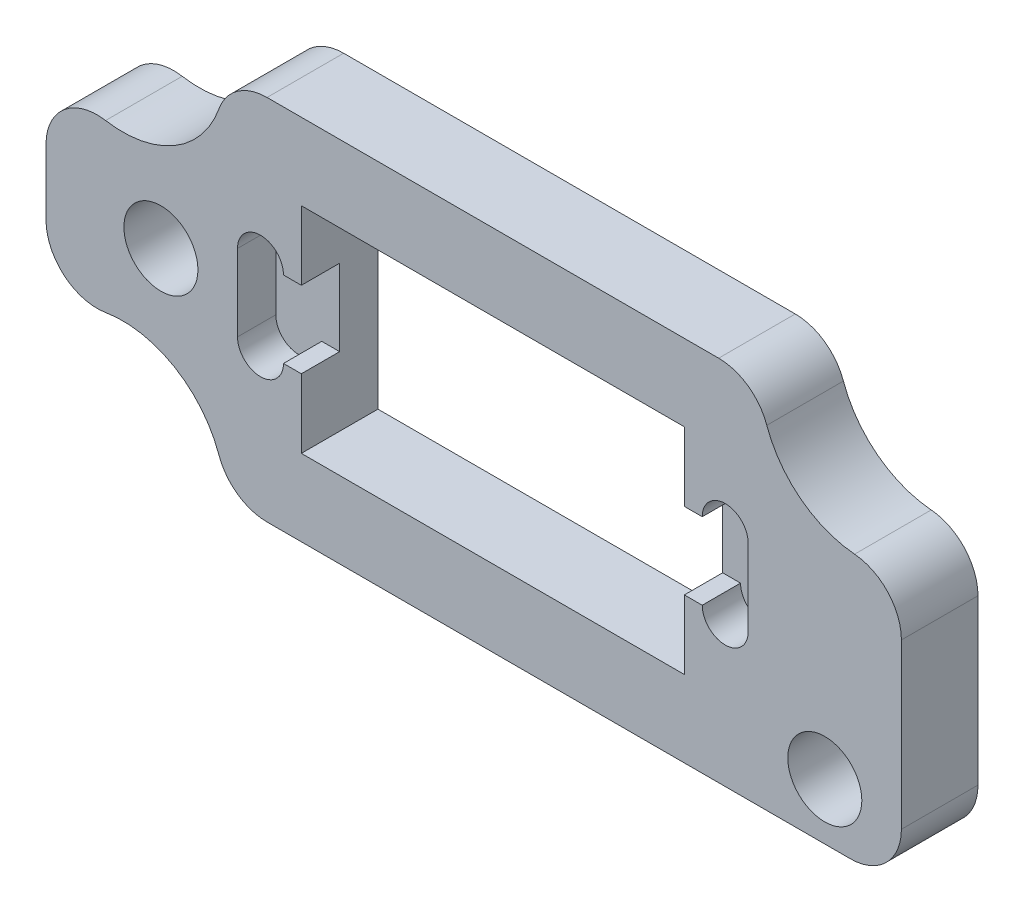
from build123d import *

# Parameters (mm, degrees)
SKETCH_1_W          = 35
SKETCH_1_H          = 14.4
SKETCH_1_W_2        = 15
SKETCH_1_H_2        = 8.4
EXTRUDE_1_DEPTH     = 3
SKETCH_2_W          = 20
SKETCH_2_H          = 3
CUT_EXTRUDE_1_DEPTH = 1.5
SKETCH_3_R          = 1.45
CUT_EXTRUDE_2_DEPTH = 20
SKETCH_5_R          = 4
CUT_EXTRUDE_4_DEPTH = 10
SKETCH_9_W          = 1.5
SKETCH_9_H          = 14.4
CUT_EXTRUDE_7_DEPTH = 20.159592898
FILLET_2_R          = 2
SKETCH_6_R          = 0.9
CUT_EXTRUDE_5_DEPTH = 1.5
SKETCH_7_R          = 1.45
CUT_EXTRUDE_6_DEPTH = 20.159592898


with BuildPart() as part:
    # 草图1 → 凸台-拉伸1 (new body)
    with BuildSketch(Plane.XY):
        Rectangle(SKETCH_1_W, SKETCH_1_H)
        Rectangle(SKETCH_1_W_2, SKETCH_1_H_2, mode=Mode.SUBTRACT)
    extrude(amount=EXTRUDE_1_DEPTH)

    # 草图2 → 切除-拉伸1 (cut)
    with BuildSketch(Plane.XY.offset(3)):
        Rectangle(SKETCH_2_W, SKETCH_2_H)
    extrude(amount=-CUT_EXTRUDE_1_DEPTH, mode=Mode.SUBTRACT)

    # 草图3 → 切除-拉伸2 (cut)
    with BuildSketch(Plane.XY.offset(3)):
        with Locations((-13, 0)):
            Circle(SKETCH_3_R)
    extrude(amount=-CUT_EXTRUDE_2_DEPTH, mode=Mode.SUBTRACT)

    # 草图5 → 切除-拉伸4 (cut)
    with BuildSketch(Plane.XY.offset(3)):
        with Locations((-14.5, 7.2)):
            Circle(SKETCH_5_R)
        with Locations((14.5, 7.2)):
            Circle(SKETCH_5_R)
        with Locations((-14.5, -7.2)):
            Circle(SKETCH_5_R)
    extrude(amount=-CUT_EXTRUDE_4_DEPTH, mode=Mode.SUBTRACT)

    # 草图9 → 切除-拉伸7 (cut, through all)
    with BuildSketch(Plane.XY.offset(3)):
        with Locations((16.75, 0)):
            Rectangle(SKETCH_9_W, SKETCH_9_H)
    extrude(amount=-CUT_EXTRUDE_7_DEPTH, mode=Mode.SUBTRACT)

    # 圆角2
    fillet_2_edges = [part.edges().sort_by_distance(p)[0] for p in [
        (16, -7.2, 1.5),
        (-10.5, -7.2, 1.5),
        (-17.5, 4.554248689, 1.5),
        (10.5, 7.2, 1.5),
        (-17.5, -4.554248689, 1.5),
        (-10.5, 7.2, 1.5),
        (16, 3.491900756, 1.5),
    ]]
    fillet(fillet_2_edges, radius=FILLET_2_R)

    # 草图6 → 切除-拉伸5 (cut)
    with BuildSketch(Plane.XY.offset(3)):
        with Locations((-9.1, 1.5)):
            Circle(SKETCH_6_R)
        with Locations((-9.1, -1.5)):
            Circle(SKETCH_6_R)
        with Locations((9.1, 1.5)):
            Circle(SKETCH_6_R)
        with Locations((9.1, -1.5)):
            Circle(SKETCH_6_R)
    extrude(amount=-CUT_EXTRUDE_5_DEPTH, mode=Mode.SUBTRACT)

    # 草图7 → 切除-拉伸6 (cut, through all)
    with BuildSketch(Plane.XY.offset(3)):
        with Locations((13, -5)):
            Circle(SKETCH_7_R)
    extrude(amount=-CUT_EXTRUDE_6_DEPTH, mode=Mode.SUBTRACT)


solid = part.part
